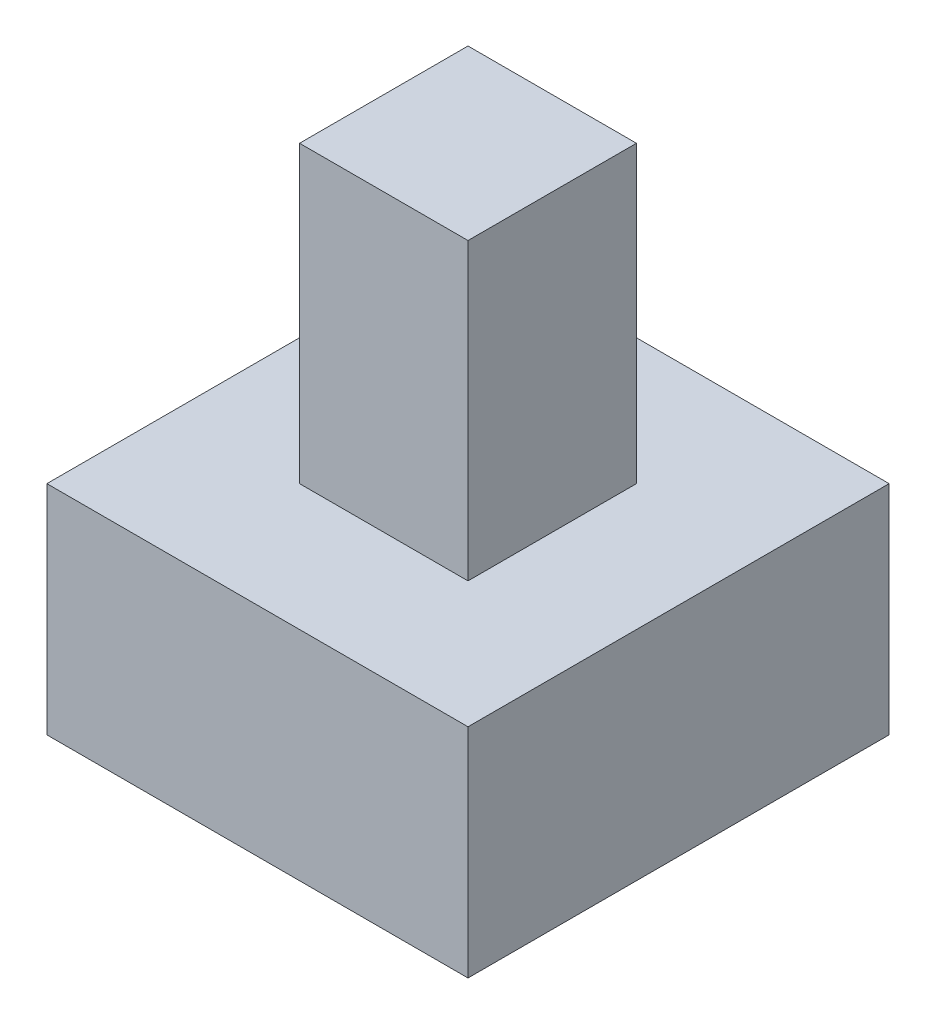
from build123d import *

# Parameters (mm, degrees)
SKETCH_1_W      = 6
SKETCH_1_H      = 6
EXTRUDE_1_DEPTH = 3.1
SKETCH_2_W      = 2.4
SKETCH_2_H      = 2.4
EXTRUDE_2_DEPTH = 4.2


with BuildPart() as part:
    # 草图1 → 拉伸1 (new body)
    with BuildSketch(Plane(origin=(0, 0, 0), x_dir=(1, 0, 0), z_dir=(0, 1, 0))):
        Rectangle(SKETCH_1_W, SKETCH_1_H)
    extrude(amount=EXTRUDE_1_DEPTH)

    # 草图2 → 拉伸2 (add)
    with BuildSketch(Plane(origin=(0, 3.1, 0), x_dir=(-1, 0, 0), z_dir=(0, 1, 0))):
        Rectangle(SKETCH_2_W, SKETCH_2_H)
    extrude(amount=EXTRUDE_2_DEPTH)


solid = part.part
